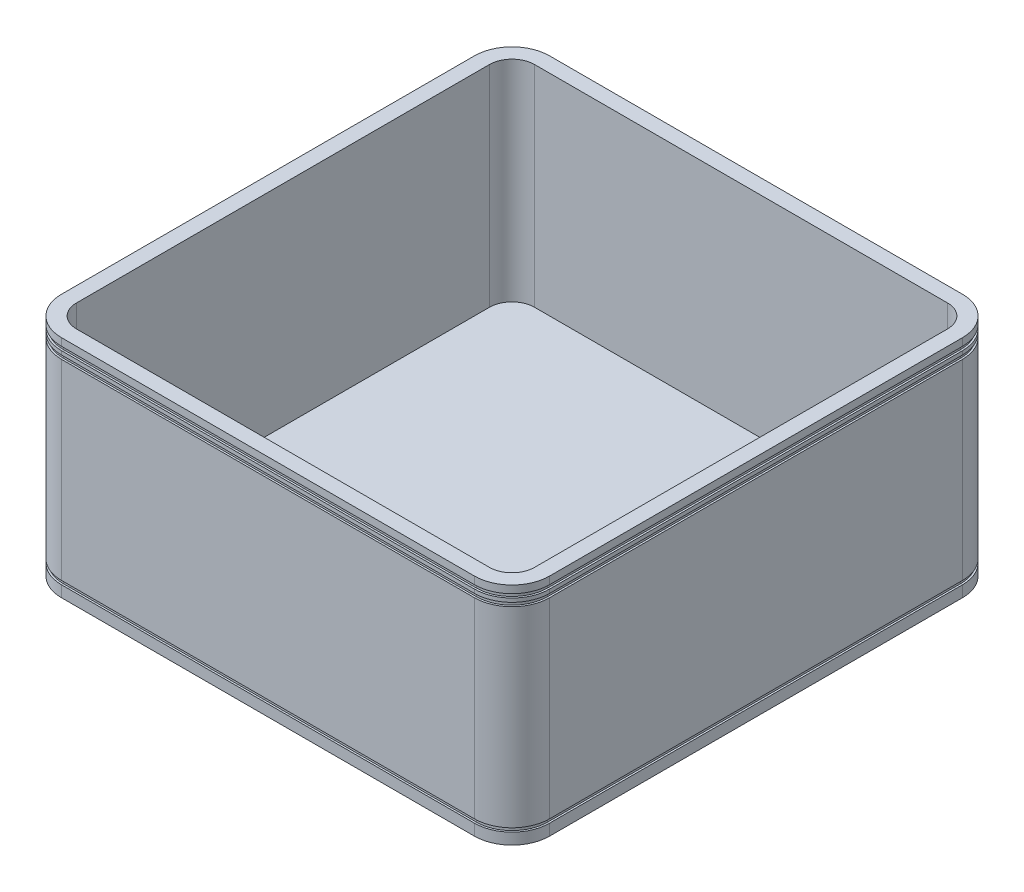
from build123d import *

# Parameters (mm, degrees)
CROQUIS1_W              = 130
CROQUIS1_H              = 130
SALIENTE_EXTRUIR1_DEPTH = 60
REDONDEO1_R             = 10
VACIADO1_T              = -4
CORTAR_EXTRUIR1_START   = -58
CORTAR_EXTRUIR1_DEPTH   = 1
CORTAR_EXTRUIR2_START   = -56
CORTAR_EXTRUIR2_DEPTH   = 1
CORTAR_EXTRUIR3_START   = -4
CORTAR_EXTRUIR3_DEPTH   = 1


with BuildPart() as part:
    # Croquis1 → Saliente-Extruir1 (new body)
    with BuildSketch(Plane(origin=(0, 0, 0), x_dir=(1, 0, 0), z_dir=(0, 1, 0))):
        Rectangle(CROQUIS1_W, CROQUIS1_H)
    extrude(amount=SALIENTE_EXTRUIR1_DEPTH)

    # Redondeo1
    redondeo1_edges = [part.edges().sort_by_distance(p)[0] for p in [
        (-65, 30, -65),
        (65, 30, -65),
        (65, 30, 65),
        (-65, 30, 65),
    ]]
    fillet(redondeo1_edges, radius=REDONDEO1_R)

    # Vaciado1
    vaciado1_openings = [part.faces().sort_by_distance(p)[0] for p in [
        (0, 60, 0),
    ]]
    offset(amount=VACIADO1_T, openings=vaciado1_openings, kind=Kind.INTERSECTION)

    # Croquis2 → Cortar-Extruir1 (cut)
    with BuildSketch(Plane.XZ.offset(CORTAR_EXTRUIR1_START)):
        with BuildLine():
            Line((55, -65), (-55, -65))
            ThreePointArc((-55, -65), (-62.071067812, -62.071067812), (-65, -55))
            Line((-65, -55), (-65, 55))
            ThreePointArc((-65, 55), (-62.071067812, 62.071067812), (-55, 65))
            Line((-55, 65), (55, 65))
            ThreePointArc((55, 65), (62.071067812, 62.071067812), (65, 55))
            Line((65, 55), (65, -55))
            ThreePointArc((65, -55), (62.071067812, -62.071067812), (55, -65))
        make_face()
        with BuildLine():
            Line((55, -64.5), (-55, -64.5))
            ThreePointArc((-55, -64.5), (-61.717514421, -61.717514421), (-64.5, -55))
            Line((-64.5, -55), (-64.5, 55))
            ThreePointArc((-64.5, 55), (-61.717514421, 61.717514421), (-55, 64.5))
            Line((-55, 64.5), (55, 64.5))
            ThreePointArc((55, 64.5), (61.717514421, 61.717514421), (64.5, 55))
            Line((64.5, 55), (64.5, -55))
            ThreePointArc((64.5, -55), (61.717514421, -61.717514421), (55, -64.5))
        make_face(mode=Mode.SUBTRACT)
    extrude(amount=CORTAR_EXTRUIR1_DEPTH, mode=Mode.SUBTRACT)

    # Croquis2<2> → Cortar-Extruir2 (cut)
    with BuildSketch(Plane.XZ.offset(CORTAR_EXTRUIR2_START)):
        with BuildLine():
            Line((55, -65), (-55, -65))
            ThreePointArc((-55, -65), (-62.071067812, -62.071067812), (-65, -55))
            Line((-65, -55), (-65, 55))
            ThreePointArc((-65, 55), (-62.071067812, 62.071067812), (-55, 65))
            Line((-55, 65), (55, 65))
            ThreePointArc((55, 65), (62.071067812, 62.071067812), (65, 55))
            Line((65, 55), (65, -55))
            ThreePointArc((65, -55), (62.071067812, -62.071067812), (55, -65))
        make_face()
        with BuildLine():
            Line((55, -64.5), (-55, -64.5))
            ThreePointArc((-55, -64.5), (-61.717514421, -61.717514421), (-64.5, -55))
            Line((-64.5, -55), (-64.5, 55))
            ThreePointArc((-64.5, 55), (-61.717514421, 61.717514421), (-55, 64.5))
            Line((-55, 64.5), (55, 64.5))
            ThreePointArc((55, 64.5), (61.717514421, 61.717514421), (64.5, 55))
            Line((64.5, 55), (64.5, -55))
            ThreePointArc((64.5, -55), (61.717514421, -61.717514421), (55, -64.5))
        make_face(mode=Mode.SUBTRACT)
    extrude(amount=CORTAR_EXTRUIR2_DEPTH, mode=Mode.SUBTRACT)

    # Croquis2<3> → Cortar-Extruir3 (cut)
    with BuildSketch(Plane.XZ.offset(CORTAR_EXTRUIR3_START)):
        with BuildLine():
            Line((55, -65), (-55, -65))
            ThreePointArc((-55, -65), (-62.071067812, -62.071067812), (-65, -55))
            Line((-65, -55), (-65, 55))
            ThreePointArc((-65, 55), (-62.071067812, 62.071067812), (-55, 65))
            Line((-55, 65), (55, 65))
            ThreePointArc((55, 65), (62.071067812, 62.071067812), (65, 55))
            Line((65, 55), (65, -55))
            ThreePointArc((65, -55), (62.071067812, -62.071067812), (55, -65))
        make_face()
        with BuildLine():
            Line((55, -64.5), (-55, -64.5))
            ThreePointArc((-55, -64.5), (-61.717514421, -61.717514421), (-64.5, -55))
            Line((-64.5, -55), (-64.5, 55))
            ThreePointArc((-64.5, 55), (-61.717514421, 61.717514421), (-55, 64.5))
            Line((-55, 64.5), (55, 64.5))
            ThreePointArc((55, 64.5), (61.717514421, 61.717514421), (64.5, 55))
            Line((64.5, 55), (64.5, -55))
            ThreePointArc((64.5, -55), (61.717514421, -61.717514421), (55, -64.5))
        make_face(mode=Mode.SUBTRACT)
    extrude(amount=CORTAR_EXTRUIR3_DEPTH, mode=Mode.SUBTRACT)


solid = part.part
